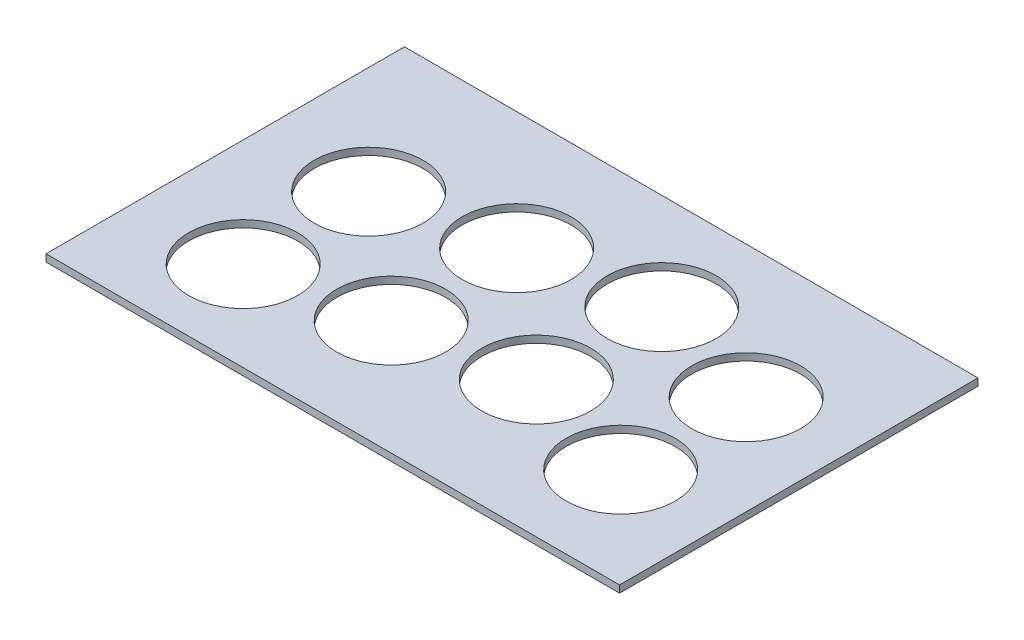
from build123d import *

# Parameters (mm, degrees)
SKETCH1_W           = 160
SKETCH1_H           = 100
SKETCH1_R           = 15.2
BOSS_EXTRUDE1_DEPTH = 2


with BuildPart() as part:
    # Sketch1 → Boss-Extrude1 (new body)
    with BuildSketch(Plane(origin=(0, 0, 0), x_dir=(1, 0, 0), z_dir=(0, 1, 0))):
        with Locations((-80, -50)):
            Rectangle(SKETCH1_W, SKETCH1_H)
        with Locations(Location((-130, -40, 0), (0, 0, 270))):
            Circle(SKETCH1_R, mode=Mode.SUBTRACT)
        with Locations(Location((-95.707143601, -33, 0), (0, 0, 270))):
            Circle(SKETCH1_R, mode=Mode.SUBTRACT)
        with Locations(Location((-61.225264302, -27, 0), (0, 0, 270))):
            Circle(SKETCH1_R, mode=Mode.SUBTRACT)
        with Locations(Location((-27.684244639, -37, 0), (0, 0, 270))):
            Circle(SKETCH1_R, mode=Mode.SUBTRACT)
        with Locations(Location((-27.684244639, -72, 0), (0, 0, 270))):
            Circle(SKETCH1_R, mode=Mode.SUBTRACT)
        with Locations(Location((-61.225264302, -62, 0), (0, 0, 270))):
            Circle(SKETCH1_R, mode=Mode.SUBTRACT)
        with Locations(Location((-95.707143601, -68, 0), (0, 0, 270))):
            Circle(SKETCH1_R, mode=Mode.SUBTRACT)
        with Locations(Location((-130, -75, 0), (0, 0, 270))):
            Circle(SKETCH1_R, mode=Mode.SUBTRACT)
    extrude(amount=BOSS_EXTRUDE1_DEPTH)


solid = part.part
